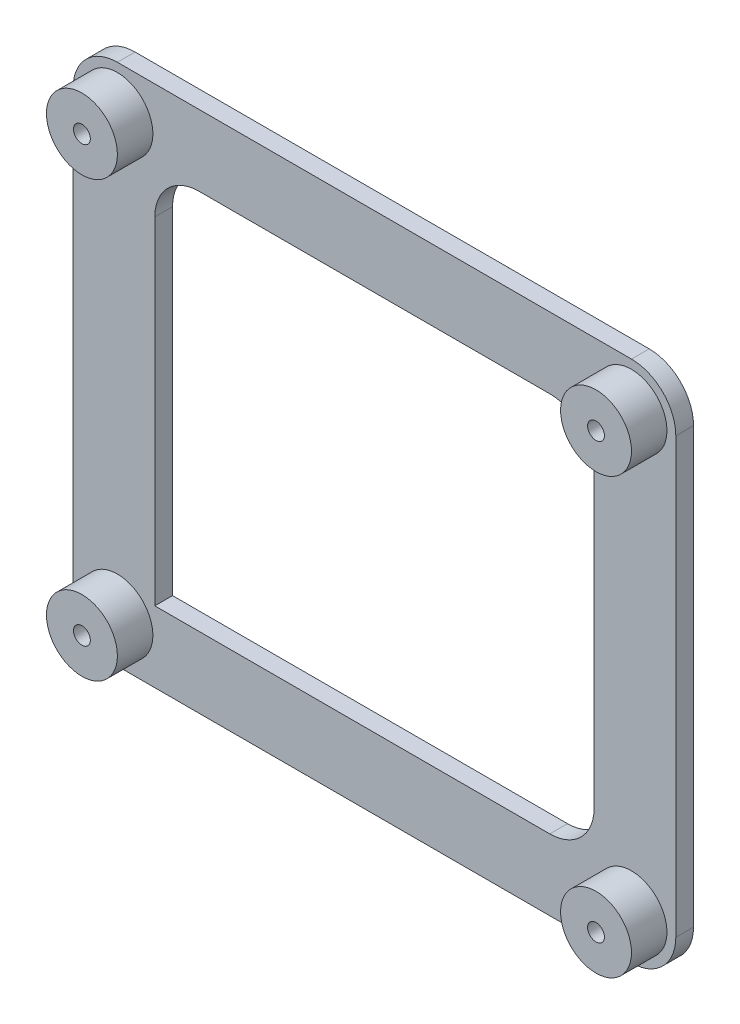
from build123d import *

# Parameters (mm, degrees)
SKETCH1_W           = 68
SKETCH1_H           = 59
SKETCH1_R           = 0.95
SKETCH1_W_2         = 49.559322034
SKETCH1_H_2         = 43
BOSS_EXTRUDE1_DEPTH = 2
SKETCH2_R           = 4
SKETCH2_R_2         = 0.95
BOSS_EXTRUDE2_DEPTH = 4
FILLET1_R           = 5


with BuildPart() as part:
    # Sketch1 → Boss-Extrude1 (new body)
    with BuildSketch(Plane.XY):
        Rectangle(SKETCH1_W, SKETCH1_H)
        with Locations((-29, 24.5)):
            Circle(SKETCH1_R, mode=Mode.SUBTRACT)
        with Locations((29, 24.5)):
            Circle(SKETCH1_R, mode=Mode.SUBTRACT)
        with Locations((29, -24.5)):
            Circle(SKETCH1_R, mode=Mode.SUBTRACT)
        with Locations((-29, -24.5)):
            Circle(SKETCH1_R, mode=Mode.SUBTRACT)
        Rectangle(SKETCH1_W_2, SKETCH1_H_2, mode=Mode.SUBTRACT)
    extrude(amount=BOSS_EXTRUDE1_DEPTH)

    # Sketch2 → Boss-Extrude2 (add)
    # profile 1 of 4: a face of its own
    with BuildSketch(Plane.XY.offset(2)):
        with Locations(Location((-29, 24.5, 0), (0, 0, 180))):
            Circle(SKETCH2_R)
        with Locations((-29, 24.5)):
            Circle(SKETCH2_R_2, mode=Mode.SUBTRACT)
    # profile 2 of 4: a face of its own
    with BuildSketch(Plane.XY.offset(2)):
        with Locations(Location((29, 24.5, 0), (0, 0, 180))):
            Circle(SKETCH2_R)
        with Locations((29, 24.5)):
            Circle(SKETCH2_R_2, mode=Mode.SUBTRACT)
    # profile 3 of 4: a face of its own
    with BuildSketch(Plane.XY.offset(2)):
        with Locations(Location((29, -24.5, 0), (0, 0, 180))):
            Circle(SKETCH2_R)
        with Locations((29, -24.5)):
            Circle(SKETCH2_R_2, mode=Mode.SUBTRACT)
    # profile 4 of 4: a face of its own
    with BuildSketch(Plane.XY.offset(2)):
        with Locations(Location((-29, -24.5, 0), (0, 0, 180))):
            Circle(SKETCH2_R)
        with Locations((-29, -24.5)):
            Circle(SKETCH2_R_2, mode=Mode.SUBTRACT)
    extrude(amount=BOSS_EXTRUDE2_DEPTH)

    # Fillet1
    fillet1_edges = [part.edges().sort_by_distance(p)[0] for p in [
        (24.779661017, -21.5, 1),
        (24.779661017, 21.5, 1),
        (-24.779661017, 21.5, 1),
        (34, -29.5, 1),
        (-34, -29.5, 1),
        (-34, 29.5, 1),
        (34, 29.5, 1),
    ]]
    fillet(fillet1_edges, radius=FILLET1_R)


solid = part.part
